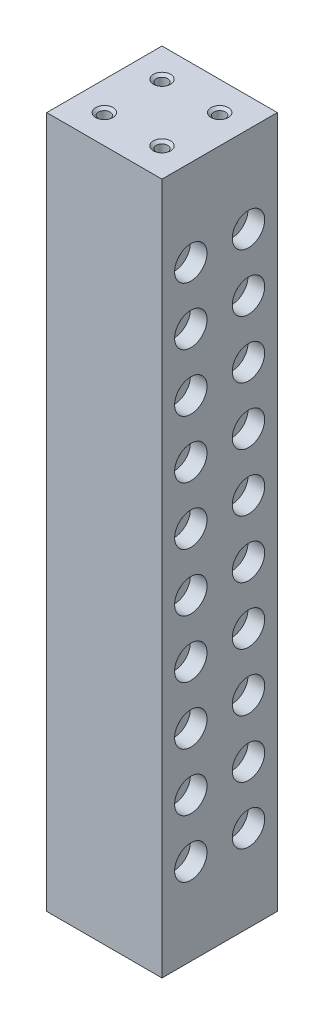
from build123d import *

# Parameters (mm, degrees)
SKETCH1_W                                            = 50.8
SKETCH1_H                                            = 50.8
BOSS_EXTRUDE1_DEPTH                                  = 304.8
F_1_4_20_TAPPED_HOLE1_AT_2_COUNT                     = 2
F_1_4_20_TAPPED_HOLE1_AT_2_PITCH                     = 25.4
F_1_4_20_TAPPED_HOLE1_AT_3_COUNT                     = 2
F_1_4_20_TAPPED_HOLE1_AT_3_PITCH                     = 35.921024484
F_1_4_20_TAPPED_HOLE1_AT_4_COUNT                     = 2
F_1_4_20_TAPPED_HOLE1_AT_4_PITCH                     = 25.4
CBORE_FOR_1_4_BINDING_HEAD_MACHINE_SCREW_D           = 6.7564
CBORE_FOR_1_4_BINDING_HEAD_MACHINE_SCREW_CBORE_D     = 14.2875
CBORE_FOR_1_4_BINDING_HEAD_MACHINE_SCREW_CBORE_DEPTH = 7.366


with BuildPart() as part:
    # Sketch1 → Boss-Extrude1 (new body)
    with BuildSketch(Plane(origin=(0, 0, 0), x_dir=(1, 0, 0), z_dir=(0, 1, 0))):
        Rectangle(SKETCH1_W, SKETCH1_H)
    extrude(amount=BOSS_EXTRUDE1_DEPTH)

    # Sketch3 → 1/4-20 Tapped Hole1 (revolve, cut)
    with BuildSketch(Plane(origin=(-12.7, 304.8, -12.7), x_dir=(0, 0, 1), z_dir=(1, 0, 0))):
        Polygon((0, 0), (0, 26.933816902), (2.5527, 25.4), (2.5527, 1.054999966), (3.81, 0), align=None)
    f_1_4_20_tapped_hole1 = revolve(axis=Axis((-12.7, 311.15, -12.7), (0, -1, 0)), mode=Mode.SUBTRACT)

    # 1/4-20 Tapped Hole1 at 2: 1/4-20 Tapped Hole1 ×2
    with Locations(*[(i * F_1_4_20_TAPPED_HOLE1_AT_2_PITCH, 0, 0) for i in range(1, F_1_4_20_TAPPED_HOLE1_AT_2_COUNT)]):
        add(f_1_4_20_tapped_hole1, mode=Mode.SUBTRACT)

    # 1/4-20 Tapped Hole1 at 3: 1/4-20 Tapped Hole1 ×2
    with Locations(*[Vector(0.7071067811865476, 0, 0.7071067811865475) * (i * F_1_4_20_TAPPED_HOLE1_AT_3_PITCH) for i in range(1, F_1_4_20_TAPPED_HOLE1_AT_3_COUNT)]):
        add(f_1_4_20_tapped_hole1, mode=Mode.SUBTRACT)

    # 1/4-20 Tapped Hole1 at 4: 1/4-20 Tapped Hole1 ×2
    with Locations(*[(0, 0, i * F_1_4_20_TAPPED_HOLE1_AT_4_PITCH) for i in range(1, F_1_4_20_TAPPED_HOLE1_AT_4_COUNT)]):
        add(f_1_4_20_tapped_hole1, mode=Mode.SUBTRACT)

    # Mirror1: 1/4-20 Tapped Hole1 across plane
    add(f_1_4_20_tapped_hole1.mirror(Plane(origin=(0, 152.4, 0), x_dir=(0, 0, 1), z_dir=(0, -1, 0))), mode=Mode.SUBTRACT)

    # Mirror1 copy 1 sketch → Mirror1 copy 1 (revolve, cut)
    with BuildSketch(Plane(origin=(12.7, 0, -12.7), x_dir=(0, 0, 1), z_dir=(1, 0, 0))):
        Polygon((0, 0), (0, -26.933816902), (2.5527, -25.4), (2.5527, -1.054999966), (3.81, 0), align=None)
    revolve(axis=Axis((12.7, -6.35, -12.7), (0, -1, 0)), mode=Mode.SUBTRACT)

    # Mirror1 copy 2 sketch → Mirror1 copy 2 (revolve, cut)
    with BuildSketch(Plane(origin=(12.7, 0, 12.7), x_dir=(0, 0, 1), z_dir=(1, 0, 0))):
        Polygon((0, 0), (0, -26.933816902), (2.5527, -25.4), (2.5527, -1.054999966), (3.81, 0), align=None)
    revolve(axis=Axis((12.7, -6.35, 12.7), (0, -1, 0)), mode=Mode.SUBTRACT)

    # Mirror1 copy 3 sketch → Mirror1 copy 3 (revolve, cut)
    with BuildSketch(Plane(origin=(-12.7, 0, 12.7), x_dir=(0, 0, 1), z_dir=(1, 0, 0))):
        Polygon((0, 0), (0, -26.933816902), (2.5527, -25.4), (2.5527, -1.054999966), (3.81, 0), align=None)
    revolve(axis=Axis((-12.7, -6.35, 12.7), (0, -1, 0)), mode=Mode.SUBTRACT)

    # CBORE for 1/4 Binding Head Machine Screw1 (through all)
    with Locations(Plane(origin=(25.4, 0, 0), x_dir=(0, 0, -1), z_dir=(1, 0, 0))):
        with Locations((-12.7, 266.7), (12.7, 266.7), (12.7, 241.3), (12.7, 215.9), (12.7, 190.5), (-12.7, 241.3), (-12.7, 215.9), (-12.7, 190.5), (-12.7, 165.1), (12.7, 165.1), (-12.7, 139.7), (12.7, 139.7), (-12.7, 114.3), (12.7, 114.3), (-12.7, 88.9), (12.7, 88.9), (-12.7, 63.5), (12.7, 63.5), (-12.7, 38.1), (12.7, 38.1)):
            CounterBoreHole(CBORE_FOR_1_4_BINDING_HEAD_MACHINE_SCREW_D / 2, CBORE_FOR_1_4_BINDING_HEAD_MACHINE_SCREW_CBORE_D / 2, CBORE_FOR_1_4_BINDING_HEAD_MACHINE_SCREW_CBORE_DEPTH)


solid = part.part
